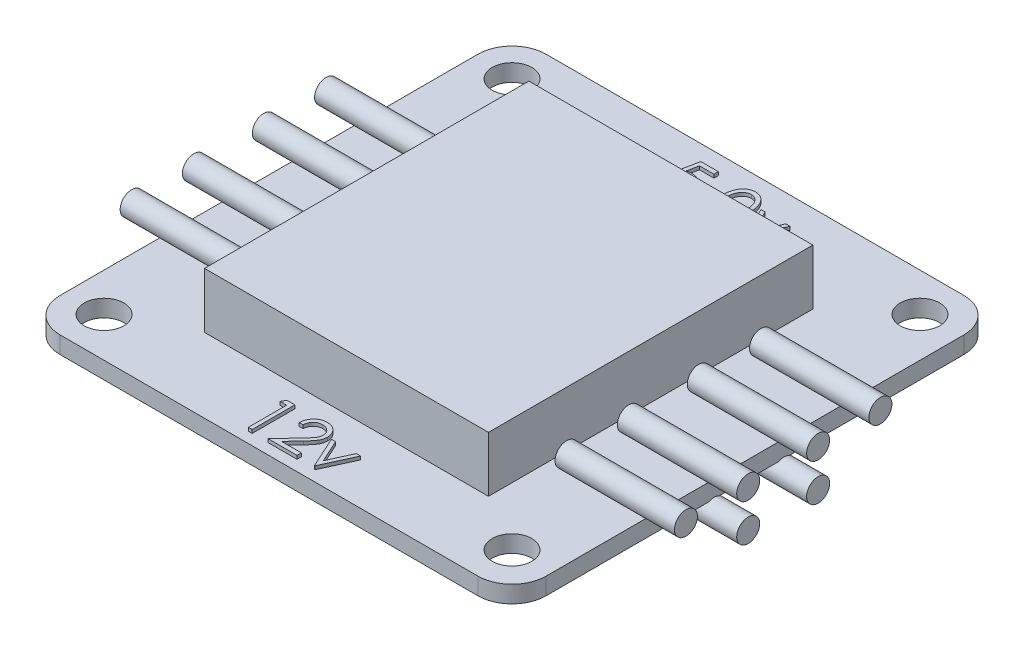
from build123d import *

# Parameters (mm, degrees)
SKETCH1_W                  = 36.195
SKETCH1_H                  = 36.195
BOSS_EXTRUDE1_DEPTH        = 1.27
SKETCH2_W                  = 21.1455
SKETCH2_H                  = 24.1554
BOSS_EXTRUDE2_DEPTH        = 4.1275
BOSS_EXTRUDE3_DEPTH        = 0.254
F_4_CLEARANCE_HOLE1_D      = 2.9464
FILLET1_R                  = 2.54
BOSS_EXTRUDE4_DEPTH        = 2.54
BOSS_EXTRUDE4_DEPTH_BACK   = 6.35
SKETCH6_R                  = 0.85725
BOSS_EXTRUDE5_DEPTH        = 2.54
BOSS_EXTRUDE5_DEPTH_BACK   = 6.35
SKETCH7_R                  = 0.85725
BOSS_EXTRUDE5_2_DEPTH      = 2.54
BOSS_EXTRUDE5_2_DEPTH_BACK = 6.35
BOSS_EXTRUDE5_3_DEPTH      = 2.54
BOSS_EXTRUDE5_3_DEPTH_BACK = 6.35
BOSS_EXTRUDE5_4_DEPTH      = 2.54
BOSS_EXTRUDE5_4_DEPTH_BACK = 6.35
BOSS_EXTRUDE5_5_DEPTH      = 2.54
BOSS_EXTRUDE5_5_DEPTH_BACK = 6.35
BOSS_EXTRUDE5_6_DEPTH      = 2.54
BOSS_EXTRUDE5_6_DEPTH_BACK = 6.35


with BuildPart() as part:
    # Sketch1 → Boss-Extrude1 (new body)
    with BuildSketch(Plane(origin=(0, 0, 0), x_dir=(1, 0, 0), z_dir=(0, 1, 0))):
        Rectangle(SKETCH1_W, SKETCH1_H)
    extrude(amount=BOSS_EXTRUDE1_DEPTH)

    # Sketch2 → Boss-Extrude2 (add)
    with BuildSketch(Plane(origin=(0, 1.27, 0), x_dir=(1, 0, 0), z_dir=(0, 1, 0))):
        with Locations((0.23495, -0.4826)):
            Rectangle(SKETCH2_W, SKETCH2_H)
    extrude(amount=BOSS_EXTRUDE2_DEPTH)

    # Sketch3 → Boss-Extrude3 (add)
    # profile 1 of 7: a face of its own
    with BuildSketch(Plane(origin=(0, 1.27, 0), x_dir=(1, 0, 0), z_dir=(0, 1, 0))):
        with BuildLine():
            Line((-1.313330352, 16.681366794), (-1.313330352, 16.355725769))
            Line((-1.313330352, 16.355725769), (-2.393288284, 16.355725769))
            Line((-2.393288284, 16.355725769), (-2.564377026, 15.520634623))
            add(Edge.make_bspline(
                [(-2.564377026, 15.520634623), (-2.530762054, 15.529914941), (-2.465638363, 15.547894089), (-2.369517632, 15.567856467), (-2.278266133, 15.579890119), (-2.219052047, 15.581533237), (-2.190398661, 15.582328333)],
                knots=[0, 0, 0, 0, 1.100273476, 2.13160584, 3.095893838, 4, 4, 4, 4], degree=3))
            add(Edge.make_bspline(
                [(-2.190398661, 15.582328333), (-2.154944126, 15.581560948), (-2.085231651, 15.580052079), (-1.983233463, 15.565563329), (-1.885867196, 15.542757835), (-1.793336474, 15.510898505), (-1.705470118, 15.470158961), (-1.623076544, 15.419268301), (-1.544919009, 15.359820208), (-1.472399656, 15.291471518), (-1.406609747, 15.216249766), (-1.348764885, 15.13537084), (-1.299631678, 15.049620747), (-1.260115851, 14.958180194), (-1.22856149, 14.862060105), (-1.207559324, 14.76024912), (-1.193574166, 14.653706897), (-1.192011716, 14.580859179), (-1.191214967, 14.543711546)],
                knots=[0, 0, 0, 0, 1.052922333, 2.070308379, 3.05430497, 4.020497103, 4.973039431, 5.925935799, 6.892292201, 7.88610001, 8.88166317, 9.857072816, 10.836096531, 11.812156883, 12.81219415, 13.836441305, 14.89672472, 16, 16, 16, 16], degree=3))
            add(Edge.make_bspline(
                [(-1.191214967, 14.543711546), (-1.191818285, 14.517837817), (-1.193016768, 14.466440022), (-1.199111487, 14.390109211), (-1.21084603, 14.315394355), (-1.226601037, 14.242285543), (-1.24705023, 14.170921184), (-1.2718053, 14.101097012), (-1.302100268, 14.033247619), (-1.335330159, 13.96673101), (-1.372746606, 13.903050936), (-1.414274252, 13.843497927), (-1.458148662, 13.787178614), (-1.505357633, 13.734697013), (-1.556339965, 13.68639799), (-1.61047822, 13.641994906), (-1.667340401, 13.600736842), (-1.727806228, 13.564298551), (-1.790528338, 13.530767869), (-1.856412506, 13.503260089), (-1.923958999, 13.478666967), (-1.994139993, 13.459064038), (-2.066796523, 13.443703793), (-2.142048355, 13.433271105), (-2.21950082, 13.425672479), (-2.272001724, 13.425196813), (-2.298521658, 13.424956538)],
                knots=[0, 0, 0, 0, 1.056347294, 2.098418968, 3.122841568, 4.141288669, 5.149314143, 6.15115421, 7.162517403, 8.180376062, 9.185164535, 10.17417709, 11.141909838, 12.097768115, 13.052685741, 14.0056014, 14.954263652, 15.917497458, 16.885230207, 17.854509472, 18.828990115, 19.81800267, 20.826176721, 21.857883937, 22.917946725, 24, 24, 24, 24], degree=3))
            add(Edge.make_bspline(
                [(-2.298521658, 13.424956538), (-2.330157522, 13.425583227), (-2.392397347, 13.426816163), (-2.483583861, 13.43971436), (-2.571317825, 13.458187341), (-2.654892988, 13.485978815), (-2.735058349, 13.520801575), (-2.810734671, 13.564812673), (-2.883855625, 13.614686575), (-2.951448687, 13.673542323), (-3.014183161, 13.737872978), (-3.070341209, 13.807684552), (-3.120355239, 13.881824832), (-3.163424338, 13.960653872), (-3.200161829, 14.043964539), (-3.229022568, 14.132068975), (-3.252316504, 14.224506836), (-3.262171179, 14.288146092), (-3.267176505, 14.320469358)],
                knots=[0, 0, 0, 0, 1.0467383, 2.05933395, 3.04377827, 4.011590433, 4.970194871, 5.932262533, 6.905835911, 7.896367577, 8.894135286, 9.877477877, 10.858688626, 11.851381753, 12.8477658, 13.868841284, 14.917554742, 16, 16, 16, 16], degree=3))
            Line((-3.267176505, 14.320469358), (-2.982240608, 14.320469358))
            add(Edge.make_bspline(
                [(-2.982240608, 14.320469358), (-2.975229702, 14.290192148), (-2.961754352, 14.231997668), (-2.93217628, 14.150235666), (-2.896012236, 14.077374656), (-2.85300972, 14.01245082), (-2.801710764, 13.955836943), (-2.743173353, 13.905384323), (-2.677543633, 13.859868313), (-2.604615489, 13.821929088), (-2.52767791, 13.789572433), (-2.447153369, 13.768026253), (-2.365234427, 13.752876157), (-2.309827619, 13.751359631), (-2.281985199, 13.750597564)],
                knots=[0, 0, 0, 0, 1.136247022, 2.183929868, 3.172523383, 4.106158343, 5.02341133, 5.958108904, 6.928429099, 7.938127109, 8.96079061, 9.975095812, 10.982467395, 12, 12, 12, 12], degree=3))
            add(Edge.make_bspline(
                [(-2.281985199, 13.750597564), (-2.25480861, 13.751342126), (-2.201297685, 13.752808177), (-2.122547355, 13.764092138), (-2.046517105, 13.781470792), (-1.973957146, 13.807478446), (-1.903597749, 13.839087583), (-1.837218686, 13.879650545), (-1.772899647, 13.926332133), (-1.712639841, 13.979814219), (-1.657449769, 14.038751013), (-1.608685287, 14.101776934), (-1.56806623, 14.169011502), (-1.533836003, 14.239290719), (-1.507843368, 14.313384839), (-1.489300477, 14.39094662), (-1.478411988, 14.472167637), (-1.476914132, 14.527566225), (-1.476150864, 14.555795881)],
                knots=[0, 0, 0, 0, 1.027316725, 2.022795036, 3.002884548, 3.971462791, 4.93288096, 5.914575861, 6.907176829, 7.935150275, 8.956128384, 9.956726525, 10.942570165, 11.921478529, 12.907843606, 13.90538589, 14.932640048, 16, 16, 16, 16], degree=3))
            add(Edge.make_bspline(
                [(-1.476150864, 14.555795881), (-1.476748199, 14.581264598), (-1.477917397, 14.631115989), (-1.487470129, 14.704049555), (-1.50408624, 14.773058672), (-1.527149331, 14.838476584), (-1.556431456, 14.900364993), (-1.592214896, 14.958787769), (-1.635171193, 15.012974889), (-1.684240263, 15.062951705), (-1.737995772, 15.10907527), (-1.797362595, 15.148394549), (-1.861098386, 15.181472531), (-1.928435237, 15.210018501), (-2.000974824, 15.230520606), (-2.077280626, 15.245912902), (-2.15817664, 15.254816838), (-2.213485764, 15.256052265), (-2.241916089, 15.256687307)],
                knots=[0, 0, 0, 0, 1.045622112, 2.046656509, 3.013763289, 3.955457236, 4.890082067, 5.820317437, 6.762574623, 7.722996705, 8.69280354, 9.665887285, 10.63943826, 11.638615906, 12.663482002, 13.728887084, 14.832589034, 16, 16, 16, 16], degree=3))
            add(Edge.make_bspline(
                [(-2.241916089, 15.256687307), (-2.266525903, 15.256160628), (-2.317338925, 15.255073169), (-2.395283204, 15.247066276), (-2.477190695, 15.234149201), (-2.562747416, 15.216381677), (-2.652210306, 15.193130629), (-2.745390569, 15.165268189), (-2.842484125, 15.13195609), (-2.907905204, 15.10679901), (-2.94153548, 15.093866794)],
                knots=[0, 0, 0, 0, 0.817624296, 1.688186739, 2.600797293, 3.572016777, 4.590301741, 5.671205678, 6.80286297, 8, 8, 8, 8], degree=3))
            Line((-2.94153548, 15.093866794), (-2.615894454, 16.681366794))
            Line((-2.615894454, 16.681366794), (-1.313330352, 16.681366794))
        make_face()
    # profile 2 of 7: a face of its own
    with BuildSketch(Plane(origin=(0, 1.27, 0), x_dir=(1, 0, 0), z_dir=(0, 1, 0))):
        with BuildLine():
            add(Edge.make_bspline(
                [(-0.356759839, 13.994828333), (-0.339079432, 13.99377771), (-0.304419062, 13.991718087), (-0.254309281, 13.977587819), (-0.208956982, 13.952497463), (-0.168559875, 13.919057657), (-0.135261857, 13.878512305), (-0.109277337, 13.833521731), (-0.095270158, 13.782992429), (-0.093225538, 13.748131224), (-0.092176505, 13.730244999)],
                knots=[0, 0, 0, 0, 1.020151414, 1.999887582, 2.974338812, 3.990962822, 5.007586832, 5.987933904, 6.967670073, 8, 8, 8, 8], degree=3))
            add(Edge.make_bspline(
                [(-0.092176505, 13.730244999), (-0.093261086, 13.71278855), (-0.095399863, 13.678364689), (-0.109245229, 13.628216505), (-0.135459889, 13.583197813), (-0.168330204, 13.542102302), (-0.208966969, 13.508591655), (-0.254416501, 13.483714764), (-0.304301428, 13.468572753), (-0.339059807, 13.466643898), (-0.356759839, 13.465661666)],
                knots=[0, 0, 0, 0, 1.009421747, 1.99056486, 2.972319754, 3.999869655, 5.017953583, 5.993804169, 6.978383603, 8, 8, 8, 8], degree=3))
            add(Edge.make_bspline(
                [(-0.356759839, 13.465661666), (-0.374472625, 13.466608358), (-0.409052622, 13.468456548), (-0.458751346, 13.484025665), (-0.504477667, 13.508358376), (-0.54510652, 13.542164786), (-0.578252134, 13.582986345), (-0.603312302, 13.628526546), (-0.618361937, 13.678221136), (-0.620341208, 13.712760276), (-0.621343172, 13.730244999)],
                knots=[0, 0, 0, 0, 1.022052826, 1.995314843, 2.982371812, 4.00089066, 5.028879526, 6.005146991, 6.990147033, 8, 8, 8, 8], degree=3))
            add(Edge.make_bspline(
                [(-0.621343172, 13.730244999), (-0.620379696, 13.748160508), (-0.618498628, 13.78313834), (-0.603280708, 13.833211816), (-0.578446573, 13.878721757), (-0.544877393, 13.918995798), (-0.504487496, 13.952729994), (-0.458861653, 13.977281628), (-0.408932927, 13.991832573), (-0.374452483, 13.993812428), (-0.356759839, 13.994828333)],
                knots=[0, 0, 0, 0, 1.032775665, 2.016367738, 2.991239715, 4.008302682, 5.025365648, 6.011011707, 6.979408107, 8, 8, 8, 8], degree=3))
        make_face()
    # profile 3 of 7: a face of its own
    with BuildSketch(Plane(origin=(0, 1.27, 0), x_dir=(1, 0, 0), z_dir=(0, 1, 0))):
        with BuildLine():
            add(Edge.make_bspline(
                [(0.314874777, 15.092594759), (0.315172336, 15.143483104), (0.315750349, 15.242334446), (0.32218056, 15.3863748), (0.332862477, 15.521503063), (0.34750138, 15.647725701), (0.365315833, 15.765075302), (0.389097025, 15.87323826), (0.416141496, 15.972715189), (0.4474855, 16.063830476), (0.482852994, 16.147811678), (0.521346931, 16.226211682), (0.564494994, 16.298911863), (0.609831194, 16.367072573), (0.659190716, 16.429578068), (0.711168905, 16.487311054), (0.767794464, 16.538937235), (0.827142479, 16.585969238), (0.889750271, 16.627198402), (0.953833261, 16.663513814), (1.019832536, 16.69453798), (1.087928287, 16.718931447), (1.157508465, 16.739079858), (1.228816304, 16.752858403), (1.301969541, 16.761527884), (1.351346629, 16.762356711), (1.376388198, 16.762777051)],
                knots=[0, 0, 0, 0, 1.646270934, 3.197905019, 4.663502075, 6.030701355, 7.308322542, 8.50163776, 9.611534131, 10.641858119, 11.616356847, 12.558055219, 13.465016945, 14.349605745, 15.204443733, 16.039544428, 16.859896111, 17.680448484, 18.487036065, 19.28249412, 20.06191084, 20.843045899, 21.620316918, 22.403196591, 23.190181807, 24, 24, 24, 24], degree=3))
            add(Edge.make_bspline(
                [(1.376388198, 16.762777051), (1.401638954, 16.762334533), (1.451854762, 16.761454503), (1.526095674, 16.752996356), (1.598621456, 16.738961837), (1.669122911, 16.719076381), (1.738179148, 16.694406017), (1.805250032, 16.663484133), (1.870752171, 16.627489732), (1.933644646, 16.585195214), (1.994617904, 16.538039864), (2.05217427, 16.484733728), (2.106318984, 16.425815055), (2.157731583, 16.361914221), (2.204953446, 16.291805608), (2.249923631, 16.216708594), (2.290175406, 16.135309881), (2.328941861, 16.0489676), (2.362403628, 15.955292709), (2.392580865, 15.854813248), (2.416963929, 15.746342378), (2.437274198, 15.630449213), (2.453008496, 15.506708139), (2.464468107, 15.37538441), (2.470521549, 15.236391627), (2.471661556, 15.141361292), (2.472246572, 15.092594759)],
                knots=[0, 0, 0, 0, 0.810914788, 1.612654377, 2.396697861, 3.181598691, 3.963628158, 4.749916497, 5.551656086, 6.361998678, 7.18212741, 8.025565596, 8.878627764, 9.750805457, 10.657531673, 11.591944965, 12.560506719, 13.57287815, 14.630710178, 15.753379473, 16.941251878, 18.199788006, 19.531962791, 20.947069417, 22.433333509, 24, 24, 24, 24], degree=3))
            add(Edge.make_bspline(
                [(2.472246572, 15.092594759), (2.471655491, 15.044040928), (2.470503795, 14.949435769), (2.464535969, 14.811068384), (2.452780639, 14.680441588), (2.438075864, 14.557242097), (2.417709633, 14.441982686), (2.392667804, 14.334264507), (2.364863582, 14.233622385), (2.330542019, 14.140880806), (2.292976589, 14.054746029), (2.25210509, 13.974312259), (2.208317462, 13.89886855), (2.160611957, 13.82901878), (2.109763504, 13.764268141), (2.054683795, 13.705759583), (1.996925479, 13.652083331), (1.935772787, 13.604320783), (1.871899452, 13.562515282), (1.806622289, 13.525128432), (1.738783077, 13.49498163), (1.669919184, 13.469096271), (1.599045595, 13.449320147), (1.526250655, 13.435646007), (1.451904641, 13.42605583), (1.401647507, 13.425324237), (1.376388198, 13.424956538)],
                knots=[0, 0, 0, 0, 1.561518951, 3.042555995, 4.452378317, 5.7783523, 7.031515105, 8.214008947, 9.334062868, 10.386615937, 11.391082383, 12.354592575, 13.286541444, 14.194233754, 15.072674879, 15.931287219, 16.775624067, 17.606195743, 18.42308326, 19.229000347, 20.022332153, 20.807536673, 21.593273796, 22.3848459, 23.188221202, 24, 24, 24, 24], degree=3))
            add(Edge.make_bspline(
                [(1.376388198, 13.424956538), (1.351347323, 13.425379589), (1.301971606, 13.426213763), (1.228808334, 13.434844077), (1.157794975, 13.448719283), (1.088581105, 13.468147202), (1.020811624, 13.491927804), (0.955409992, 13.522910074), (0.891649022, 13.558591694), (0.829698825, 13.59922754), (0.770723507, 13.645783639), (0.714391201, 13.697276958), (0.662117076, 13.754992481), (0.61346329, 13.818018882), (0.56722251, 13.885776324), (0.52468715, 13.959189919), (0.485343589, 14.037968573), (0.44938128, 14.122621249), (0.417496421, 14.214383219), (0.389331714, 14.31430426), (0.367093871, 14.423266301), (0.348059333, 14.540394199), (0.3327065, 14.666191264), (0.322225076, 14.800725791), (0.315746883, 14.943913945), (0.315170784, 15.042130098), (0.314874777, 15.092594759)],
                knots=[0, 0, 0, 0, 0.810891512, 1.598919785, 2.382837074, 3.152667961, 3.926044502, 4.706494248, 5.493654104, 6.291793342, 7.103789334, 7.925228297, 8.761435821, 9.622817696, 10.50288917, 11.416980706, 12.369136599, 13.353924996, 14.394355917, 15.514179734, 16.714354668, 17.994756427, 19.357759367, 20.818452758, 22.365282078, 24, 24, 24, 24], degree=3))
        make_face()
        with BuildLine():
            add(Edge.make_bspline(
                [(0.599810674, 15.093866794), (0.59991903, 15.051459046), (0.600129326, 14.969153934), (0.605623166, 14.849553262), (0.613107305, 14.738001606), (0.622760481, 14.634357327), (0.637096013, 14.538971244), (0.653158599, 14.451187317), (0.672705795, 14.371470109), (0.695833418, 14.299272595), (0.722176028, 14.233369512), (0.750937775, 14.172045552), (0.781835717, 14.114576295), (0.816415232, 14.061477951), (0.854075325, 14.012577359), (0.893965353, 13.967009004), (0.937574054, 13.926371742), (0.997902449, 13.87763381), (1.077546394, 13.827270024), (1.17789495, 13.783413214), (1.281008473, 13.755851986), (1.350995679, 13.752347007), (1.385928463, 13.750597564)],
                knots=[0, 0, 0, 0, 1.459021318, 2.831673884, 4.118529203, 5.306027144, 6.411944654, 7.436330062, 8.375795394, 9.233974572, 10.042671642, 10.816086306, 11.563610507, 12.285937304, 12.993564865, 13.685989202, 14.367179055, 15.041617293, 16.353048772, 17.594441528, 18.799311195, 20, 20, 20, 20], degree=3))
            add(Edge.make_bspline(
                [(1.385928463, 13.750597564), (1.421087208, 13.752046979), (1.491332108, 13.754942817), (1.593960622, 13.782881672), (1.693592367, 13.825036183), (1.771671913, 13.87488142), (1.831073934, 13.92235069), (1.873634347, 13.96282255), (1.912697777, 14.008139658), (1.949747373, 14.057034019), (1.983728106, 14.110439773), (2.014628238, 14.168100109), (2.042825275, 14.230175149), (2.058889909, 14.273509126), (2.067103342, 14.295664671)],
                knots=[0, 0, 0, 0, 1.353760809, 2.704726607, 4.075137775, 5.516104923, 6.260822281, 7.007110065, 7.778089737, 8.566572457, 9.372053459, 10.217411131, 11.088608312, 12, 12, 12, 12], degree=3))
            add(Edge.make_bspline(
                [(2.067103342, 14.295664671), (2.076675303, 14.323994506), (2.096110489, 14.381516221), (2.121158312, 14.470746105), (2.140884496, 14.564365755), (2.158631263, 14.661815683), (2.170744393, 14.763814554), (2.180494195, 14.870046774), (2.186237032, 14.980592438), (2.186948914, 15.055699323), (2.187310674, 15.093866794)],
                knots=[0, 0, 0, 0, 0.884706709, 1.796334032, 2.740027952, 3.714592787, 4.726048262, 5.777819803, 6.87074269, 8, 8, 8, 8], degree=3))
            add(Edge.make_bspline(
                [(2.187310674, 15.093866794), (2.186811574, 15.132028092), (2.185835227, 15.206679749), (2.182103253, 15.316006956), (2.172466153, 15.419845567), (2.161762666, 15.518642925), (2.145980902, 15.611852128), (2.128964891, 15.700253476), (2.106103791, 15.782751791), (2.08168371, 15.860638698), (2.05373428, 15.933029291), (2.022967863, 16.000261083), (1.990109554, 16.062658655), (1.954420521, 16.120050809), (1.916324437, 16.172694616), (1.874815803, 16.21953457), (1.831541122, 16.262022391), (1.77092839, 16.310520578), (1.691576712, 16.359970474), (1.592838161, 16.405477984), (1.490085505, 16.431611221), (1.420622443, 16.435295752), (1.385928463, 16.437136025)],
                knots=[0, 0, 0, 0, 1.31362396, 2.569729283, 3.763502607, 4.902122613, 5.988968491, 7.01645872, 7.998833611, 8.933434873, 9.825090667, 10.667526885, 11.477055099, 12.250526234, 12.991942729, 13.710640831, 14.402115721, 15.076753259, 16.378508321, 17.609869233, 18.806226677, 20, 20, 20, 20], degree=3))
            add(Edge.make_bspline(
                [(1.385928463, 16.437136025), (1.350812425, 16.435293213), (1.280516378, 16.431604231), (1.176695734, 16.405575351), (1.077178215, 16.360206446), (0.998036373, 16.310356794), (0.937381367, 16.262878469), (0.894670638, 16.221706471), (0.854623753, 16.176670226), (0.817732339, 16.127319917), (0.783179918, 16.074283477), (0.751447143, 16.017143669), (0.722856422, 15.955610932), (0.696472593, 15.889737451), (0.673274421, 15.817546166), (0.654139183, 15.73792715), (0.636461642, 15.650422434), (0.623947362, 15.554519737), (0.612822384, 15.450849498), (0.605672875, 15.339019359), (0.600110949, 15.2192181), (0.59991277, 15.136487435), (0.599810674, 15.093866794)],
                knots=[0, 0, 0, 0, 1.207732386, 2.417664972, 3.655092373, 4.956220595, 5.625982001, 6.301752483, 6.994047911, 7.697131622, 8.419323945, 9.170223765, 9.943494443, 10.752040957, 11.610060368, 12.549350801, 13.567764191, 14.679664412, 15.874934091, 17.154273443, 18.533957287, 20, 20, 20, 20], degree=3))
        make_face(mode=Mode.SUBTRACT)
    # profile 4 of 7: a face of its own
    with BuildSketch(Plane(origin=(0, 1.27, 0), x_dir=(1, 0, 0), z_dir=(0, 1, 0))):
        Polygon((2.716477341, 15.826559102), (3.02494589, 15.826559102), (3.795163238, 14.137296281), (4.565380586, 15.826559102), (4.873849136, 15.826559102), (3.815515802, 13.506366794), (3.774810674, 13.506366794), align=None)
    # profile 5 of 7: a face of its own
    with BuildSketch(Plane(origin=(0, 1.27, 0), x_dir=(1, 0, 0), z_dir=(0, 1, 0))):
        Polygon((-2.63306693, -14.12519094), (-2.046022659, -14.12519094), (-2.046022659, -17.30019094), (-2.330958557, -17.30019094), (-2.330958557, -14.450831966), (-2.819420095, -14.450831966), align=None)
    # profile 6 of 7: a face of its own
    with BuildSketch(Plane(origin=(0, 1.27, 0), x_dir=(1, 0, 0), z_dir=(0, 1, 0))):
        with BuildLine():
            Line((-0.458522659, -15.102114017), (-0.743458557, -15.102114017))
            add(Edge.make_bspline(
                [(-0.743458557, -15.102114017), (-0.741601496, -15.064312569), (-0.73795428, -14.990071531), (-0.720874331, -14.881827702), (-0.696435107, -14.778363706), (-0.661880717, -14.680510284), (-0.618967165, -14.587402223), (-0.567504926, -14.499409351), (-0.506550504, -14.416867344), (-0.43742011, -14.340541394), (-0.36233713, -14.27052124), (-0.281323885, -14.210055413), (-0.196193039, -14.15896724), (-0.10720287, -14.116257827), (-0.013349358, -14.084199539), (0.084515806, -14.060412765), (0.186822594, -14.046101366), (0.256527471, -14.044563046), (0.291978142, -14.043780684)],
                knots=[0, 0, 0, 0, 1.10065271, 2.161652631, 3.183658789, 4.190468796, 5.17591951, 6.163126047, 7.15150782, 8.156236427, 9.156009102, 10.134482811, 11.092018607, 12.041330605, 13.001268258, 13.972401359, 14.968799086, 16, 16, 16, 16], degree=3))
            add(Edge.make_bspline(
                [(0.291978142, -14.043780684), (0.326792538, -14.044595712), (0.395201582, -14.046197214), (0.495043552, -14.059950433), (0.590091526, -14.081491077), (0.680159715, -14.111712919), (0.764529502, -14.152338793), (0.843834692, -14.201140845), (0.919019428, -14.257583121), (0.986698439, -14.324034795), (1.048845053, -14.394975529), (1.102459242, -14.470710985), (1.148372612, -14.548933265), (1.186642864, -14.630238848), (1.214815219, -14.715393281), (1.236204022, -14.803156815), (1.24829389, -14.894437894), (1.250149381, -14.956220269), (1.251092725, -14.987630844)],
                knots=[0, 0, 0, 0, 1.111607364, 2.184268762, 3.212621178, 4.221274766, 5.211760367, 6.196651075, 7.1921475, 8.207485113, 9.220403448, 10.201281604, 11.166441695, 12.114753415, 13.065576456, 14.026450734, 14.996634279, 16, 16, 16, 16], degree=3))
            add(Edge.make_bspline(
                [(1.251092725, -14.987630844), (1.249556694, -15.031852094), (1.246511587, -15.119518574), (1.220463545, -15.248346342), (1.179781353, -15.373163229), (1.130798036, -15.473617782), (1.081383748, -15.554565308), (1.036854366, -15.621211919), (0.984725573, -15.69297188), (0.92423865, -15.769604893), (0.85664483, -15.851711214), (0.781331868, -15.939241243), (0.697762709, -16.031290634), (0.639108212, -16.094160715), (0.608714921, -16.126738416)],
                knots=[0, 0, 0, 0, 1.184426356, 2.348067706, 3.509069118, 4.696110526, 5.333549288, 6.050745305, 6.844228056, 7.710549037, 8.667450064, 9.695053472, 10.805634456, 12, 12, 12, 12], degree=3))
            Line((0.608714921, -16.126738416), (-0.185671097, -16.974549915))
            Line((-0.185671097, -16.974549915), (1.291797854, -16.974549915))
            Line((1.291797854, -16.974549915), (1.291797854, -17.30019094))
            Line((1.291797854, -17.30019094), (-0.865573941, -17.30019094))
            Line((-0.865573941, -17.30019094), (0.365756187, -15.986178521))
            add(Edge.make_bspline(
                [(0.365756187, -15.986178521), (0.395735341, -15.954883628), (0.453319162, -15.894772545), (0.534764785, -15.807012859), (0.607915867, -15.725597205), (0.673245931, -15.650679407), (0.729337753, -15.581163628), (0.779114707, -15.519301289), (0.818997778, -15.462374038), (0.862282459, -15.39638791), (0.904205142, -15.315822451), (0.940229922, -15.21736689), (0.962196249, -15.11601431), (0.96483135, -15.047523177), (0.966156828, -15.013071549)],
                knots=[0, 0, 0, 0, 1.329631726, 2.553950428, 3.673215718, 4.687767853, 5.603093632, 6.413772471, 7.123043292, 7.734684054, 8.834405432, 9.900288307, 10.943827018, 12, 12, 12, 12], degree=3))
            add(Edge.make_bspline(
                [(0.966156828, -15.013071549), (0.965580119, -14.991407709), (0.964443536, -14.948712441), (0.954412625, -14.886114359), (0.939253808, -14.825730564), (0.917532039, -14.767375317), (0.88886021, -14.711635332), (0.853959358, -14.658442761), (0.813691229, -14.607017771), (0.767108292, -14.558800136), (0.715934985, -14.514639329), (0.661874487, -14.475519623), (0.604679035, -14.442827001), (0.544589782, -14.416026828), (0.481774249, -14.395003447), (0.416110944, -14.380436021), (0.347781301, -14.371289768), (0.301123773, -14.370052269), (0.277349737, -14.36942171)],
                knots=[0, 0, 0, 0, 0.991446411, 1.95395049, 2.89581595, 3.838931463, 4.798493298, 5.75982156, 6.748411868, 7.785213223, 8.824556874, 9.840280684, 10.836137867, 11.835679398, 12.848801643, 13.863922112, 14.911575587, 16, 16, 16, 16], degree=3))
            add(Edge.make_bspline(
                [(0.277349737, -14.36942171), (0.252520481, -14.370070346), (0.203759923, -14.371344161), (0.132169086, -14.38025472), (0.063874131, -14.395627018), (-0.001296738, -14.416651573), (-0.063453791, -14.443374685), (-0.122294745, -14.476659339), (-0.177687509, -14.516377222), (-0.229736213, -14.561408298), (-0.277691394, -14.611543908), (-0.319825345, -14.667432946), (-0.356640844, -14.728054959), (-0.388762077, -14.793246372), (-0.414847596, -14.86359873), (-0.434780382, -14.938862291), (-0.450552736, -15.018710258), (-0.455821894, -15.073851014), (-0.458522659, -15.102114017)],
                knots=[0, 0, 0, 0, 1.031018746, 2.02475058, 2.990194455, 3.934040569, 4.864654155, 5.795059489, 6.735614925, 7.690564532, 8.649604399, 9.611025574, 10.590972636, 11.591080095, 12.624614302, 13.701020113, 14.821632451, 16, 16, 16, 16], degree=3))
        make_face()
    # profile 7 of 7: a face of its own
    with BuildSketch(Plane(origin=(0, 1.27, 0), x_dir=(1, 0, 0), z_dir=(0, 1, 0))):
        Polygon((1.536028623, -14.979998633), (1.844497172, -14.979998633), (2.61471452, -16.669261453), (3.384931868, -14.979998633), (3.693400418, -14.979998633), (2.635067084, -17.30019094), (2.594361956, -17.30019094), align=None)
    extrude(amount=BOSS_EXTRUDE3_DEPTH)

    # #4 Clearance Hole1 (through all)
    with Locations(Plane(origin=(0, 1.27, 0), x_dir=(1, 0, 0), z_dir=(0, 1, 0))):
        with Locations((15.1384, 15.24), (-15.24, 15.24), (15.1384, -15.1384), (-15.24, -15.1384)):
            Hole(F_4_CLEARANCE_HOLE1_D / 2)

    # Fillet1
    fillet1_edges = [part.edges().sort_by_distance(p)[0] for p in [
        (18.0975, 0.635, 18.0975),
        (-18.0975, 0.635, 18.0975),
        (-18.0975, 0.635, -18.0975),
        (18.0975, 0.635, -18.0975),
    ]]
    fillet(fillet1_edges, radius=FILLET1_R)


with BuildPart() as body_2:
    # Sketch6 → Boss-Extrude4 (new, two sides: drawn at the far end of the back side and taken through both)
    with BuildSketch(Plane.ZY.offset(18.0975).offset(-BOSS_EXTRUDE4_DEPTH_BACK)):
        with BuildLine():
            ThreePointArc((-6.401774189, 1.27), (-6.062536284, 1.585786284), (-5.93725, 2.032))
            ThreePointArc((-5.93725, 2.032), (-7.240713716, 2.763963716), (-7.187225811, 1.27))
            Line((-7.187225811, 1.27), (-6.401774189, 1.27))
        make_face()
        with BuildLine():
            Line((-6.401774189, 1.27), (-7.187225811, 1.27))
            ThreePointArc((-7.187225811, 1.27), (-6.7945, 1.17475), (-6.401774189, 1.27))
        make_face()
        with BuildLine():
            ThreePointArc((-1.30175, 2.032), (-2.605213716, 2.763963716), (-2.551725811, 1.27))
            Line((-2.551725811, 1.27), (-1.766274189, 1.27))
            ThreePointArc((-1.766274189, 1.27), (-1.427036284, 1.585786284), (-1.30175, 2.032))
        make_face()
        with BuildLine():
            Line((-1.766274189, 1.27), (-2.551725811, 1.27))
            ThreePointArc((-2.551725811, 1.27), (-2.159, 1.17475), (-1.766274189, 1.27))
        make_face()
        with Locations((3.048, 2.032)):
            Circle(SKETCH6_R)
        with Locations((7.6835, 2.032)):
            Circle(SKETCH6_R)
    extrude(amount=BOSS_EXTRUDE4_DEPTH + BOSS_EXTRUDE4_DEPTH_BACK)


with BuildPart() as body_3:
    # Sketch7 → Boss-Extrude5 (new, two sides: drawn at the far end of the back side and taken through both)
    with BuildSketch(Plane(origin=(18.0975, 0, 0), x_dir=(0, 0, -1), z_dir=(1, 0, 0)).offset(-BOSS_EXTRUDE5_DEPTH_BACK)):
        with Locations((-7.6835, 2.032)):
            Circle(SKETCH7_R)
    extrude(amount=BOSS_EXTRUDE5_DEPTH + BOSS_EXTRUDE5_DEPTH_BACK)


with BuildPart() as body_4:
    # Sketch7 → Boss-Extrude5 2 (new, two sides: drawn at the far end of the back side and taken through both)
    with BuildSketch(Plane(origin=(18.0975, 0, 0), x_dir=(0, 0, -1), z_dir=(1, 0, 0)).offset(-BOSS_EXTRUDE5_2_DEPTH_BACK)):
        with Locations((-3.048, 2.032)):
            Circle(SKETCH7_R)
    extrude(amount=BOSS_EXTRUDE5_2_DEPTH + BOSS_EXTRUDE5_2_DEPTH_BACK)


with BuildPart() as body_5:
    # Sketch7 → Boss-Extrude5 3 (new, two sides: drawn at the far end of the back side and taken through both)
    with BuildSketch(Plane(origin=(18.0975, 0, 0), x_dir=(0, 0, -1), z_dir=(1, 0, 0)).offset(-BOSS_EXTRUDE5_3_DEPTH_BACK)):
        with Locations((2.159, 2.032)):
            Circle(SKETCH7_R)
    extrude(amount=BOSS_EXTRUDE5_3_DEPTH + BOSS_EXTRUDE5_3_DEPTH_BACK)


with BuildPart() as body_6:
    # Sketch7 → Boss-Extrude5 4 (new, two sides: drawn at the far end of the back side and taken through both)
    with BuildSketch(Plane(origin=(18.0975, 0, 0), x_dir=(0, 0, -1), z_dir=(1, 0, 0)).offset(-BOSS_EXTRUDE5_4_DEPTH_BACK)):
        with Locations((6.7945, 2.032)):
            Circle(SKETCH7_R)
    extrude(amount=BOSS_EXTRUDE5_4_DEPTH + BOSS_EXTRUDE5_4_DEPTH_BACK)


with BuildPart() as body_7:
    # Sketch7 → Boss-Extrude5 5 (new, two sides: drawn at the far end of the back side and taken through both)
    with BuildSketch(Plane(origin=(18.0975, 0, 0), x_dir=(0, 0, -1), z_dir=(1, 0, 0)).offset(-BOSS_EXTRUDE5_5_DEPTH_BACK)):
        with Locations(Location((2.159, -0.762, 0), (0, 0, 180))):
            Circle(SKETCH7_R)
    extrude(amount=BOSS_EXTRUDE5_5_DEPTH + BOSS_EXTRUDE5_5_DEPTH_BACK)


with BuildPart() as body_8:
    # Sketch7 → Boss-Extrude5 6 (new, two sides: drawn at the far end of the back side and taken through both)
    with BuildSketch(Plane(origin=(18.0975, 0, 0), x_dir=(0, 0, -1), z_dir=(1, 0, 0)).offset(-BOSS_EXTRUDE5_6_DEPTH_BACK)):
        with Locations(Location((-3.048, -0.762, 0), (0, 0, 180))):
            Circle(SKETCH7_R)
    extrude(amount=BOSS_EXTRUDE5_6_DEPTH + BOSS_EXTRUDE5_6_DEPTH_BACK)


with BuildPart() as body_2_1:
    add(body_2.part)

    # Combine1: union part, body 6, body 5, body 4, body 3, body 8, body 7
    add(part.part)
    add(body_6.part)
    add(body_5.part)
    add(body_4.part)
    add(body_3.part)
    add(body_8.part)
    add(body_7.part)


solid = body_2_1.part
